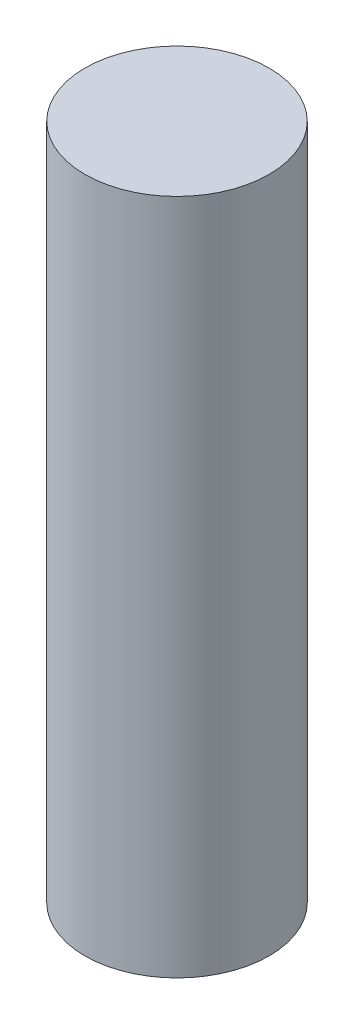
from build123d import *

# Parameters (mm, degrees)
SKETCH1_R           = 2.45
BOSS_EXTRUDE1_DEPTH = 18


with BuildPart() as part:
    # Sketch1 → Boss-Extrude1 (new body)
    with BuildSketch(Plane(origin=(0, 0, 0), x_dir=(1, 0, 0), z_dir=(0, 1, 0))):
        with Locations(Location((0, 0, 0), (0, 0, 270))):
            Circle(SKETCH1_R)
    extrude(amount=BOSS_EXTRUDE1_DEPTH)


solid = part.part
